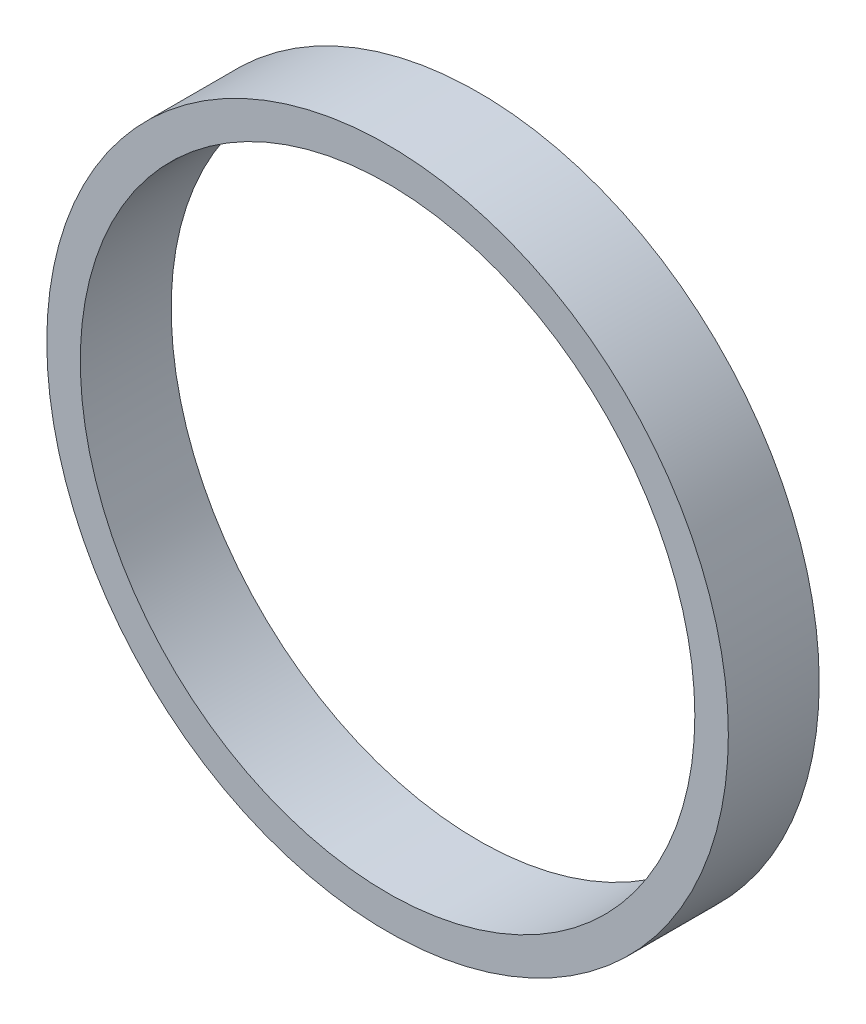
from build123d import *

# Parameters (mm, degrees)
SKETCH1_R           = 15
BOSS_EXTRUDE1_DEPTH = 4
SKETCH2_R           = 13.525
CUT_EXTRUDE1_DEPTH  = 4


with BuildPart() as part:
    # Sketch1 → Boss-Extrude1 (new body)
    with BuildSketch(Plane(origin=(0, 0, 0), x_dir=(0, 1, 0), z_dir=(0, 0, 1))):
        with Locations(Location((0, 0, 0), (0, 0, 270))):
            Circle(SKETCH1_R)
    extrude(amount=BOSS_EXTRUDE1_DEPTH)

    # Sketch2 → Cut-Extrude1 (cut)
    with BuildSketch(Plane.XY.offset(4)):
        Circle(SKETCH2_R)
    extrude(amount=-CUT_EXTRUDE1_DEPTH, mode=Mode.SUBTRACT)


solid = part.part
